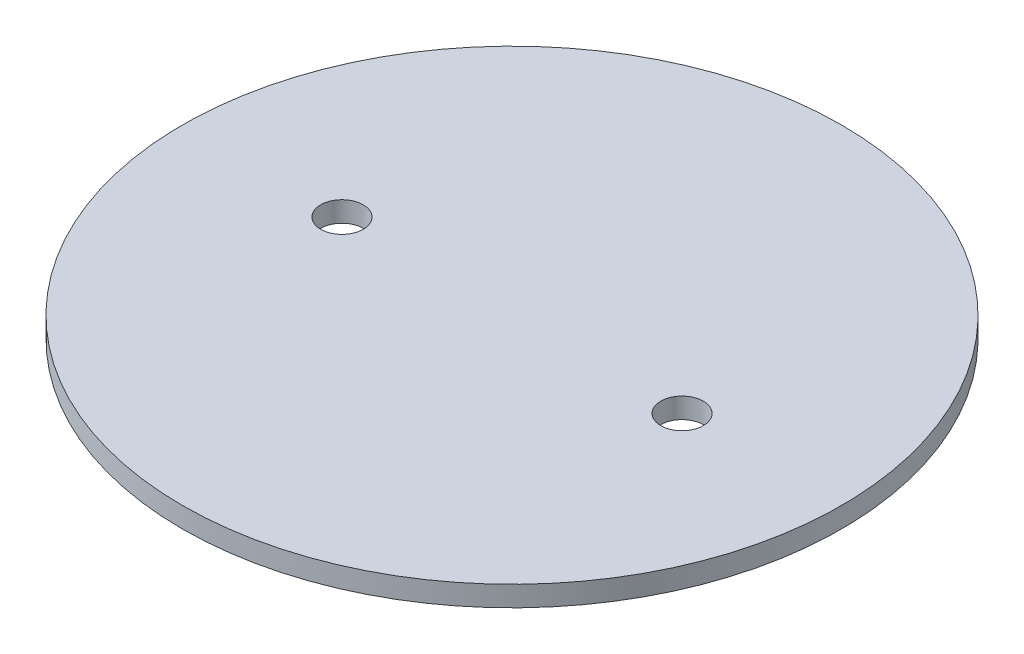
from build123d import *

# Parameters (mm, degrees)
SKETCH1_R           = 96.9
SKETCH1_R_2         = 6.25
BOSS_EXTRUDE1_DEPTH = 6


with BuildPart() as part:
    # Sketch1 → Boss-Extrude1 (new body)
    with BuildSketch(Plane(origin=(0, 0, 0), x_dir=(1, 0, 0), z_dir=(0, 1, 0))):
        with Locations(Location((0, 0, 0), (0, 0, 270))):
            Circle(SKETCH1_R)
        with Locations(Location((-50, 0, 0), (0, 0, 270))):
            Circle(SKETCH1_R_2, mode=Mode.SUBTRACT)
        with Locations(Location((50, 0, 0), (0, 0, 270))):
            Circle(SKETCH1_R_2, mode=Mode.SUBTRACT)
    extrude(amount=BOSS_EXTRUDE1_DEPTH)


solid = part.part
